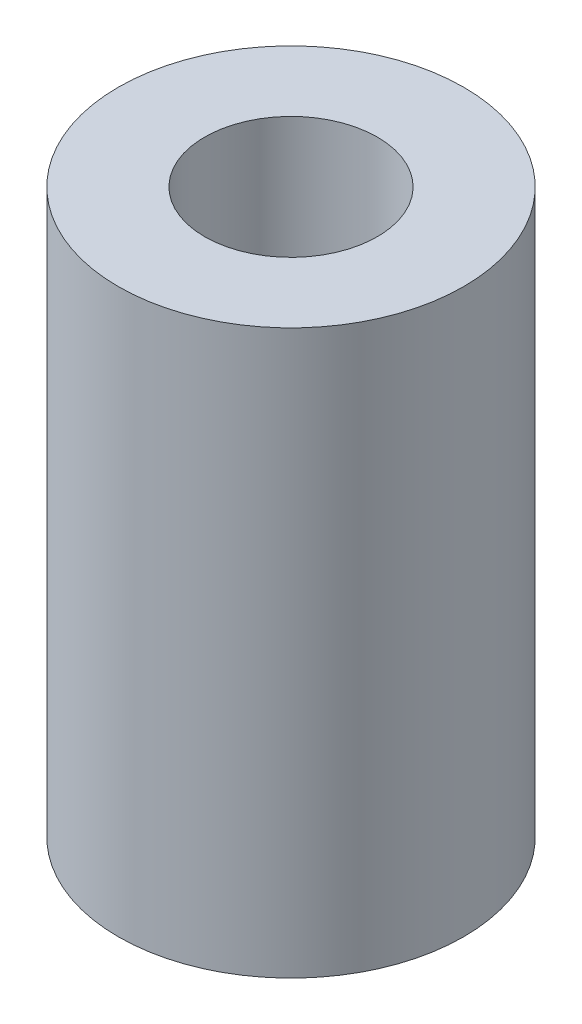
from build123d import *

# Parameters (mm, degrees)
SKETCH1_R           = 4.6
SKETCH1_R_2         = 2.3
BOSS_EXTRUDE1_DEPTH = 15


with BuildPart() as part:
    # Sketch1 → Boss-Extrude1 (new body)
    with BuildSketch(Plane(origin=(0, 0, 0), x_dir=(1, 0, 0), z_dir=(0, 1, 0))):
        with Locations(Location((0, 0, 0), (0, 0, 270))):
            Circle(SKETCH1_R)
        with Locations(Location((0, 0, 0), (0, 0, 270))):
            Circle(SKETCH1_R_2, mode=Mode.SUBTRACT)
    extrude(amount=BOSS_EXTRUDE1_DEPTH)


solid = part.part
